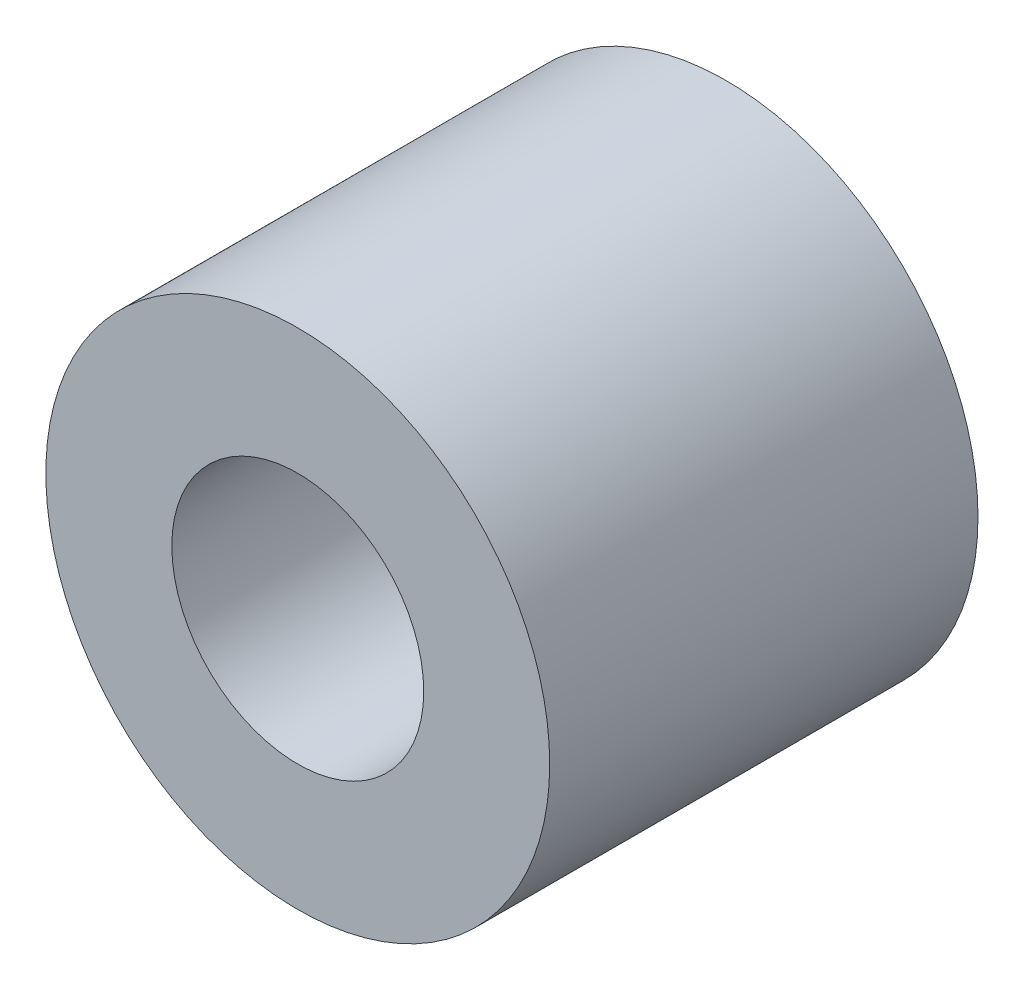
from build123d import *

# Parameters (mm, degrees)
SKETCH_1_R      = 5
SKETCH_1_R_2    = 2.5
EXTRUDE_1_DEPTH = 8.5


with BuildPart() as part:
    # 草圖1 → 伸長1 (new body)
    with BuildSketch(Plane.XY):
        Circle(SKETCH_1_R)
        Circle(SKETCH_1_R_2, mode=Mode.SUBTRACT)
    extrude(amount=EXTRUDE_1_DEPTH)


solid = part.part
